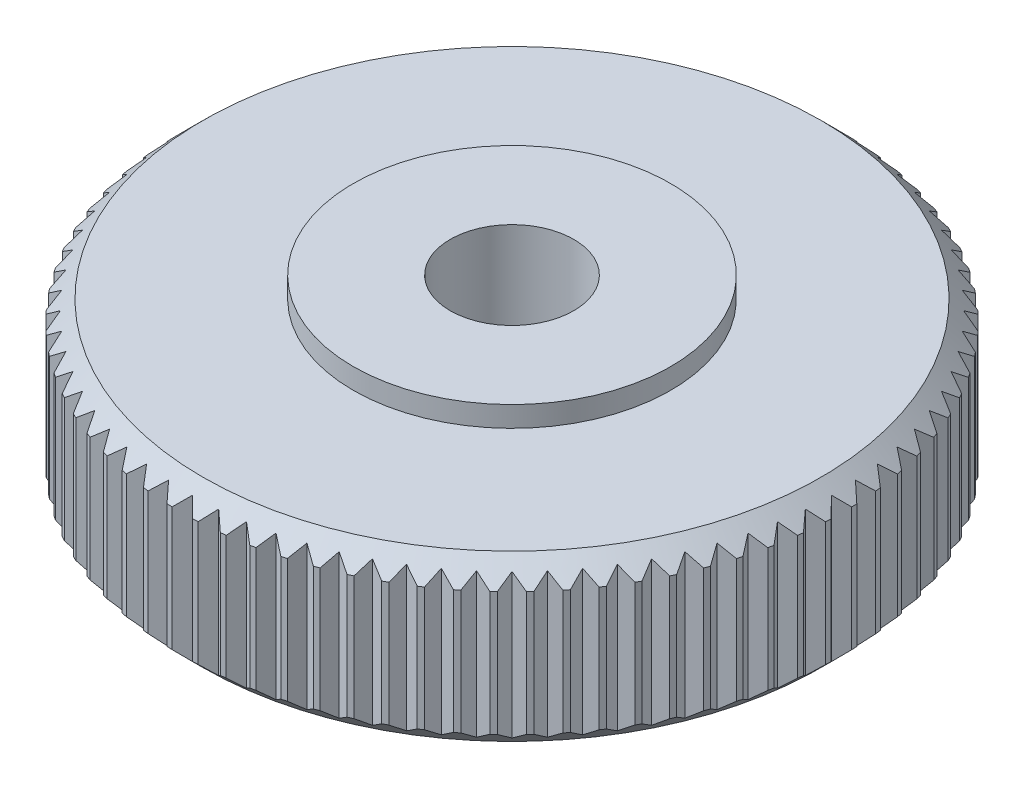
from build123d import *

# Parameters (mm, degrees)
SZKIC1_R                    = 8
SZKIC1_R_2                  = 1.5
DODANIE_WYCI_GNI_CIE1_DEPTH = 4
SFAZOWANIE1_SIZE            = 0.5
SZKIC2_R                    = 3.85
SZKIC2_R_2                  = 1.5
DODANIE_WYCI_GNI_CIE2_DEPTH = 0.5
DODANIE_WYCI_GNI_CIE3_START = -4.5
SZKIC2_2_R                  = 3.85
SZKIC2_2_R_2                = 1.5
DODANIE_WYCI_GNI_CIE3_DEPTH = 0.5
WYTNIJ_WYCI_GNI_CIE2_DEPTH  = 13.175795662


with BuildPart() as part:
    # Szkic1 → Dodanie-wyciągnięcie1 (new body)
    with BuildSketch(Plane(origin=(0, 0, 0), x_dir=(1, 0, 0), z_dir=(0, 1, 0))):
        with Locations(Location((0, 0, 0), (0, 0, 270))):
            Circle(SZKIC1_R)
        with Locations(Location((0, 0, 0), (0, 0, 270))):
            Circle(SZKIC1_R_2, mode=Mode.SUBTRACT)
    extrude(amount=DODANIE_WYCI_GNI_CIE1_DEPTH)

    # Sfazowanie1
    sfazowanie1_edges = [part.edges().sort_by_distance(p)[0] for p in [
        (0, 0, -8),
        (0, 4, -8),
    ]]
    chamfer(sfazowanie1_edges, length=SFAZOWANIE1_SIZE)

    # Szkic2 → Dodanie-wyciągnięcie2 (add)
    with BuildSketch(Plane(origin=(0, 4, 0), x_dir=(1, 0, 0), z_dir=(0, 1, 0))):
        with Locations(Location((0, 0, 0), (0, 0, 270))):
            Circle(SZKIC2_R)
        with Locations(Location((0, 0, 0), (0, 0, 270))):
            Circle(SZKIC2_R_2, mode=Mode.SUBTRACT)
    extrude(amount=DODANIE_WYCI_GNI_CIE2_DEPTH)

    # Szkic2<2> → Dodanie-wyciągnięcie3 (add)
    with BuildSketch(Plane(origin=(0, 4, 0), x_dir=(1, 0, 0), z_dir=(0, 1, 0)).offset(DODANIE_WYCI_GNI_CIE3_START)):
        with Locations(Location((0, 0, 0), (0, 0, 270))):
            Circle(SZKIC2_2_R)
        with Locations(Location((0, 0, 0), (0, 0, 270))):
            Circle(SZKIC2_2_R_2, mode=Mode.SUBTRACT)
    extrude(amount=DODANIE_WYCI_GNI_CIE3_DEPTH)

    # Szkic3 → Wytnij-wyciągnięcie2 (cut, through all)
    with BuildSketch(Plane(origin=(0, 4, 0), x_dir=(1, 0, 0), z_dir=(0, 1, 0))):
        Polygon((7.996018934, -0.252351361), (7.75, 0), (7.996165966, 0.247648617), (8.652266292, 0.247648617), (8.652266292, -0.252351361), align=None)
        Polygon((7.951570616, -0.878933861), (7.726109336, -0.608057992), (7.990946742, -0.380486752), (8.645024529, -0.43196379), (8.605794983, -0.930422435), align=None)
        Polygon((7.858098222, -1.500097442), (7.65458464, -1.212367104), (7.936460673, -1.006276294), (8.584483315, -1.108912997), (8.506266086, -1.602757146), align=None)
        Polygon((7.716178039, -2.112012422), (7.535866883, -1.80920157), (7.833043686, -1.625861807), (8.471015907, -1.779025387), (8.35429323, -2.265210326), align=None)
        Polygon((7.526685052, -2.710906144), (7.370688001, -2.394881706), (7.681333379, -2.235423342), (8.305321869, -2.438169493), (8.150813378, -2.913697731), align=None)
        Polygon((7.290787549, -3.293086229), (7.160066377, -2.965796601), (7.482265098, -2.831202749), (8.08842276, -3.082281474), (7.897081052, -3.54422122), align=None)
        Polygon((7.009939917, -3.854963341), (6.905300562, -3.518426373), (7.237066164, -3.40952685), (7.821655834, -3.707390164), (7.594660594, -4.152893407), align=None)
        Polygon((6.685873674, -4.393073323), (6.607961274, -4.049363877), (6.947248311, -3.966830083), (7.5066658, -4.309641561), (7.245416529, -4.735961625), align=None)
        Polygon((6.320586796, -4.904098546), (6.269881706, -4.555335705), (6.614598362, -4.49967649), (7.145394675, -4.885322585), (6.851502061, -5.289831065), align=None)
        Polygon((5.916331399, -5.384888372), (5.893146233, -5.033222375), (6.241167214, -5.004780895), (6.740069815, -5.430883971), (6.415345805, -5.811086937), align=None)
        Polygon((5.475599852, -5.832478569), (5.480077554, -5.480077554), (5.829257195, -5.479029162), (6.293190184, -5.942962151), (5.939636809, -6.296515526), align=None)
        Polygon((5.00110941, -6.244109597), (5.033222375, -5.893146233), (5.381407867, -5.919497392), (5.807510943, -6.418399993), (5.427307976, -6.743124003), align=None)
        Polygon((4.495785467, -6.617243613), (4.555335705, -6.269881706), (4.90038037, -6.323469952), (5.286026465, -6.854266265), (4.881517985, -7.148158878), align=None)
        Polygon((3.96274351, -6.949580122), (4.049363877, -6.607961274), (4.389140398, -6.688456217), (4.731951877, -7.247873706), (4.305631813, -7.509122977), align=None)
        Polygon((3.405269922, -7.239070158), (3.518426373, -6.905300562), (3.850839917, -7.012205925), (4.148703231, -7.596795595), (3.703199988, -7.823790836), align=None)
        Polygon((2.826801713, -7.48392892), (2.965796601, -7.160066377), (3.288797726, -7.292723052), (3.539876451, -7.898880714), (3.077936705, -8.090222422), align=None)
        Polygon((2.230905331, -7.682646771), (2.394881706, -7.370688001), (2.706479005, -7.528278116), (2.909225155, -8.152266606), (2.433696917, -8.306775097), align=None)
        Polygon((1.621254676, -7.83399855), (1.80920157, -7.535866883), (2.10747394, -7.717418843), (2.260637519, -8.355391064), (1.77445258, -8.472113741), align=None)
        Polygon((1.001608447, -7.937051122), (1.212367104, -7.65458464), (1.495475597, -7.858979116), (1.5981123, -8.507001757), (1.104268151, -8.585218986), align=None)
        Polygon((0.375786969, -7.991169136), (0.608057992, -7.726109336), (0.87425715, -7.952086169), (0.925734188, -8.606163956), (0.427275543, -8.645393502), align=None)
        Polygon((-0.252351361, -7.996018934), (0, -7.75), (0.247648617, -7.996165966), (0.247648617, -8.652266292), (-0.252351361, -8.652266292), align=None)
        Polygon((-0.878933861, -7.951570616), (-0.608057992, -7.726109336), (-0.380486752, -7.990946742), (-0.43196379, -8.645024529), (-0.930422435, -8.605794983), align=None)
        Polygon((-1.500097442, -7.858098222), (-1.212367104, -7.65458464), (-1.006276294, -7.936460673), (-1.108912997, -8.584483315), (-1.602757146, -8.506266086), align=None)
        Polygon((-2.112012422, -7.716178039), (-1.80920157, -7.535866883), (-1.625861807, -7.833043686), (-1.779025387, -8.471015907), (-2.265210326, -8.35429323), align=None)
        Polygon((-2.710906144, -7.526685052), (-2.394881706, -7.370688001), (-2.235423342, -7.681333379), (-2.438169493, -8.305321869), (-2.913697731, -8.150813378), align=None)
        Polygon((-3.293086229, -7.290787549), (-2.965796601, -7.160066377), (-2.831202749, -7.482265098), (-3.082281474, -8.08842276), (-3.54422122, -7.897081052), align=None)
        Polygon((-3.854963341, -7.009939917), (-3.518426373, -6.905300562), (-3.40952685, -7.237066164), (-3.707390164, -7.821655834), (-4.152893407, -7.594660594), align=None)
        Polygon((-4.393073323, -6.685873674), (-4.049363877, -6.607961274), (-3.966830083, -6.947248311), (-4.309641561, -7.5066658), (-4.735961625, -7.245416529), align=None)
        Polygon((-4.904098546, -6.320586796), (-4.555335705, -6.269881706), (-4.49967649, -6.614598362), (-4.885322585, -7.145394675), (-5.289831065, -6.851502061), align=None)
        Polygon((-5.384888372, -5.916331399), (-5.033222375, -5.893146233), (-5.004780895, -6.241167214), (-5.430883971, -6.740069815), (-5.811086937, -6.415345805), align=None)
        Polygon((-5.832478569, -5.475599852), (-5.480077554, -5.480077554), (-5.479029162, -5.829257195), (-5.942962151, -6.293190184), (-6.296515526, -5.939636809), align=None)
        Polygon((-6.244109597, -5.00110941), (-5.893146233, -5.033222375), (-5.919497392, -5.381407867), (-6.418399993, -5.807510943), (-6.743124003, -5.427307976), align=None)
        Polygon((-6.617243613, -4.495785467), (-6.269881706, -4.555335705), (-6.323469952, -4.90038037), (-6.854266265, -5.286026465), (-7.148158878, -4.881517985), align=None)
        Polygon((-6.949580122, -3.96274351), (-6.607961274, -4.049363877), (-6.688456217, -4.389140398), (-7.247873706, -4.731951877), (-7.509122977, -4.305631813), align=None)
        Polygon((-7.239070158, -3.405269922), (-6.905300562, -3.518426373), (-7.012205925, -3.850839917), (-7.596795595, -4.148703231), (-7.823790836, -3.703199988), align=None)
        Polygon((-7.48392892, -2.826801713), (-7.160066377, -2.965796601), (-7.292723052, -3.288797726), (-7.898880714, -3.539876451), (-8.090222422, -3.077936705), align=None)
        Polygon((-7.682646771, -2.230905331), (-7.370688001, -2.394881706), (-7.528278116, -2.706479005), (-8.152266606, -2.909225155), (-8.306775097, -2.433696917), align=None)
        Polygon((-7.83399855, -1.621254676), (-7.535866883, -1.80920157), (-7.717418843, -2.10747394), (-8.355391064, -2.260637519), (-8.472113741, -1.77445258), align=None)
        Polygon((-7.937051122, -1.001608447), (-7.65458464, -1.212367104), (-7.858979116, -1.495475597), (-8.507001757, -1.5981123), (-8.585218986, -1.104268151), align=None)
        Polygon((-7.991169136, -0.375786969), (-7.726109336, -0.608057992), (-7.952086169, -0.87425715), (-8.606163956, -0.925734188), (-8.645393502, -0.427275543), align=None)
        Polygon((-7.996018934, 0.252351361), (-7.75, 0), (-7.996165966, -0.247648617), (-8.652266292, -0.247648617), (-8.652266292, 0.252351361), align=None)
        Polygon((-7.951570616, 0.878933861), (-7.726109336, 0.608057992), (-7.990946742, 0.380486752), (-8.645024529, 0.43196379), (-8.605794983, 0.930422435), align=None)
        Polygon((-7.858098222, 1.500097442), (-7.65458464, 1.212367104), (-7.936460673, 1.006276294), (-8.584483315, 1.108912997), (-8.506266086, 1.602757146), align=None)
        Polygon((-7.716178039, 2.112012422), (-7.535866883, 1.80920157), (-7.833043686, 1.625861807), (-8.471015907, 1.779025387), (-8.35429323, 2.265210326), align=None)
        Polygon((-7.526685052, 2.710906144), (-7.370688001, 2.394881706), (-7.681333379, 2.235423342), (-8.305321869, 2.438169493), (-8.150813378, 2.913697731), align=None)
        Polygon((-7.290787549, 3.293086229), (-7.160066377, 2.965796601), (-7.482265098, 2.831202749), (-8.08842276, 3.082281474), (-7.897081052, 3.54422122), align=None)
        Polygon((-7.009939917, 3.854963341), (-6.905300562, 3.518426373), (-7.237066164, 3.40952685), (-7.821655834, 3.707390164), (-7.594660594, 4.152893407), align=None)
        Polygon((-6.685873674, 4.393073323), (-6.607961274, 4.049363877), (-6.947248311, 3.966830083), (-7.5066658, 4.309641561), (-7.245416529, 4.735961625), align=None)
        Polygon((-6.320586796, 4.904098546), (-6.269881706, 4.555335705), (-6.614598362, 4.49967649), (-7.145394675, 4.885322585), (-6.851502061, 5.289831065), align=None)
        Polygon((-5.916331399, 5.384888372), (-5.893146233, 5.033222375), (-6.241167214, 5.004780895), (-6.740069815, 5.430883971), (-6.415345805, 5.811086937), align=None)
        Polygon((-5.475599852, 5.832478569), (-5.480077554, 5.480077554), (-5.829257195, 5.479029162), (-6.293190184, 5.942962151), (-5.939636809, 6.296515526), align=None)
        Polygon((-5.00110941, 6.244109597), (-5.033222375, 5.893146233), (-5.381407867, 5.919497392), (-5.807510943, 6.418399993), (-5.427307976, 6.743124003), align=None)
        Polygon((-4.495785467, 6.617243613), (-4.555335705, 6.269881706), (-4.90038037, 6.323469952), (-5.286026465, 6.854266265), (-4.881517985, 7.148158878), align=None)
        Polygon((-3.96274351, 6.949580122), (-4.049363877, 6.607961274), (-4.389140398, 6.688456217), (-4.731951877, 7.247873706), (-4.305631813, 7.509122977), align=None)
        Polygon((-3.405269922, 7.239070158), (-3.518426373, 6.905300562), (-3.850839917, 7.012205925), (-4.148703231, 7.596795595), (-3.703199988, 7.823790836), align=None)
        Polygon((-2.826801713, 7.48392892), (-2.965796601, 7.160066377), (-3.288797726, 7.292723052), (-3.539876451, 7.898880714), (-3.077936705, 8.090222422), align=None)
        Polygon((-2.230905331, 7.682646771), (-2.394881706, 7.370688001), (-2.706479005, 7.528278116), (-2.909225155, 8.152266606), (-2.433696917, 8.306775097), align=None)
        Polygon((-1.621254676, 7.83399855), (-1.80920157, 7.535866883), (-2.10747394, 7.717418843), (-2.260637519, 8.355391064), (-1.77445258, 8.472113741), align=None)
        Polygon((-1.001608447, 7.937051122), (-1.212367104, 7.65458464), (-1.495475597, 7.858979116), (-1.5981123, 8.507001757), (-1.104268151, 8.585218986), align=None)
        Polygon((-0.375786969, 7.991169136), (-0.608057992, 7.726109336), (-0.87425715, 7.952086169), (-0.925734188, 8.606163956), (-0.427275543, 8.645393502), align=None)
        Polygon((0.252351361, 7.996018934), (0, 7.75), (-0.247648617, 7.996165966), (-0.247648617, 8.652266292), (0.252351361, 8.652266292), align=None)
        Polygon((0.878933861, 7.951570616), (0.608057992, 7.726109336), (0.380486752, 7.990946742), (0.43196379, 8.645024529), (0.930422435, 8.605794983), align=None)
        Polygon((1.500097442, 7.858098222), (1.212367104, 7.65458464), (1.006276294, 7.936460673), (1.108912997, 8.584483315), (1.602757146, 8.506266086), align=None)
        Polygon((2.112012422, 7.716178039), (1.80920157, 7.535866883), (1.625861807, 7.833043686), (1.779025387, 8.471015907), (2.265210326, 8.35429323), align=None)
        Polygon((2.710906144, 7.526685052), (2.394881706, 7.370688001), (2.235423342, 7.681333379), (2.438169493, 8.305321869), (2.913697731, 8.150813378), align=None)
        Polygon((3.293086229, 7.290787549), (2.965796601, 7.160066377), (2.831202749, 7.482265098), (3.082281474, 8.08842276), (3.54422122, 7.897081052), align=None)
        Polygon((3.854963341, 7.009939917), (3.518426373, 6.905300562), (3.40952685, 7.237066164), (3.707390164, 7.821655834), (4.152893407, 7.594660594), align=None)
        Polygon((4.393073323, 6.685873674), (4.049363877, 6.607961274), (3.966830083, 6.947248311), (4.309641561, 7.5066658), (4.735961625, 7.245416529), align=None)
        Polygon((4.904098546, 6.320586796), (4.555335705, 6.269881706), (4.49967649, 6.614598362), (4.885322585, 7.145394675), (5.289831065, 6.851502061), align=None)
        Polygon((5.384888372, 5.916331399), (5.033222375, 5.893146233), (5.004780895, 6.241167214), (5.430883971, 6.740069815), (5.811086937, 6.415345805), align=None)
        Polygon((5.832478569, 5.475599852), (5.480077554, 5.480077554), (5.479029162, 5.829257195), (5.942962151, 6.293190184), (6.296515526, 5.939636809), align=None)
        Polygon((6.244109597, 5.00110941), (5.893146233, 5.033222375), (5.919497392, 5.381407867), (6.418399993, 5.807510943), (6.743124003, 5.427307976), align=None)
        Polygon((6.617243613, 4.495785467), (6.269881706, 4.555335705), (6.323469952, 4.90038037), (6.854266265, 5.286026465), (7.148158878, 4.881517985), align=None)
        Polygon((6.949580122, 3.96274351), (6.607961274, 4.049363877), (6.688456217, 4.389140398), (7.247873706, 4.731951877), (7.509122977, 4.305631813), align=None)
        Polygon((7.239070158, 3.405269922), (6.905300562, 3.518426373), (7.012205925, 3.850839917), (7.596795595, 4.148703231), (7.823790836, 3.703199988), align=None)
        Polygon((7.48392892, 2.826801713), (7.160066377, 2.965796601), (7.292723052, 3.288797726), (7.898880714, 3.539876451), (8.090222422, 3.077936705), align=None)
        Polygon((7.682646771, 2.230905331), (7.370688001, 2.394881706), (7.528278116, 2.706479005), (8.152266606, 2.909225155), (8.306775097, 2.433696917), align=None)
        Polygon((7.83399855, 1.621254676), (7.535866883, 1.80920157), (7.717418843, 2.10747394), (8.355391064, 2.260637519), (8.472113741, 1.77445258), align=None)
        Polygon((7.937051122, 1.001608447), (7.65458464, 1.212367104), (7.858979116, 1.495475597), (8.507001757, 1.5981123), (8.585218986, 1.104268151), align=None)
        Polygon((7.991169136, 0.375786969), (7.726109336, 0.608057992), (7.952086169, 0.87425715), (8.606163956, 0.925734188), (8.645393502, 0.427275543), align=None)
    extrude(amount=-WYTNIJ_WYCI_GNI_CIE2_DEPTH, mode=Mode.SUBTRACT)


solid = part.part
